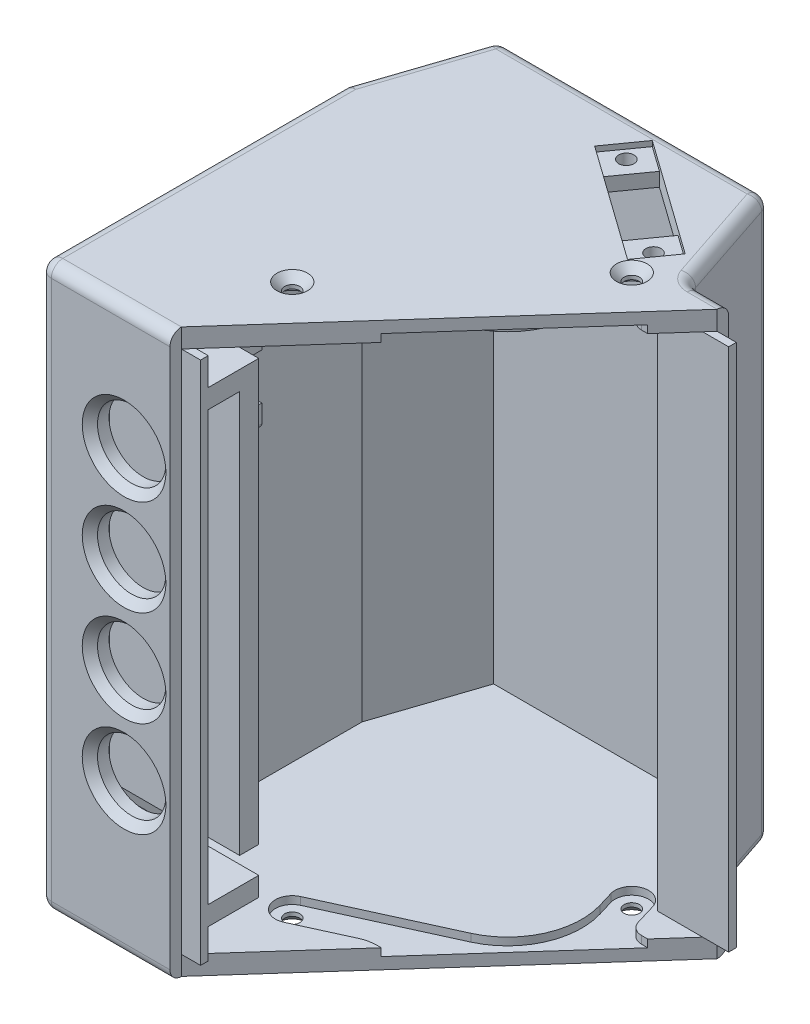
from build123d import *

# Parameters (mm, degrees)
BOSS_EXTRU_1_DEPTH       = 68.5
BOSS_EXTRU_2_DEPTH       = 2.5
ESQUISSE4_R              = 4.465
ENL_V_MAT_EXTRU_1_DEPTH  = 2.5
CHANFREIN1_SIZE          = 1
ESQUISSE6_W              = 6.6
ESQUISSE6_H              = 2.5
BOSS_EXTRU_3_DEPTH       = 17
BOSS_EXTRU_4_DEPTH       = 2.5
CONG_1_R                 = 1.5
ESQUISSE12_R             = 1
ENL_V_MAT_EXTRU_2_DEPTH  = 2.5
CHANFREIN2_SIZE          = 1
ESQUISSE13_R             = 1
ENL_V_MAT_EXTRU_3_DEPTH  = 2.5
CHANFREIN3_SIZE          = 1
ENL_V_MAT_EXTRU_4_DEPTH  = 1
ENL_V_START              = -1
ENL_V_MAT_EXTRU_5_DEPTH  = 1
ENL_V_MAT_EXTRU_6_DEPTH  = 2.5
CHANFREIN4_SIZE          = 0.5
CHANFREIN5_SIZE          = 0.5
BOSS_EXTRU_5_DEPTH       = 4
CONG_2_R                 = 0.5
ESQUISSE19_W             = 2
ESQUISSE19_H             = 6
ENL_V_MAT_EXTRU_7_DEPTH  = 1
BOSS_EXTRU_6_START       = -10.7
BOSS_EXTRU_6_DEPTH       = 9.7
ENL_V_MAT_EXTRU_8_DEPTH  = 2.5
ENL_V_MAT_EXTRU_9_DEPTH  = 0.7
ESQUISSE24_R             = 1
ENL_V_MAT_EXTRU_10_DEPTH = 1.8


with BuildPart() as part:
    # Esquisse1 → Boss.-Extru.1 (new body)
    with BuildSketch(Plane(origin=(0, 0, 0), x_dir=(1, 0, 0), z_dir=(0, 1, 0))):
        Polygon((-33, 1.5), (-35.5, 1.5), (-35.5, 0), (-52.5, 0), (-52.5, 40), (-47.5, 55), (-12.5, 55), (-7.5, 40), (-2.5, 40), (-2.5, 38.5), (0, 38.5), (0, 37.5), (-9.30189805, 37.5), (-14.30189805, 52.5), (-45.69810195, 52.5), (-50, 39.59430585), (-50, 2.5), (-33, 2.5), align=None)
    extrude(amount=BOSS_EXTRU_1_DEPTH)

    # Esquisse2 → Boss.-Extru.2 (add)
    with BuildSketch(Plane.XZ):
        Polygon((-35.5, 0), (-35.5, -1.5), (-2.5, -38.5), (-2.5, -40), (-7.5, -40), (-12.5, -55), (-47.5, -55), (-52.5, -40), (-52.5, 0), align=None)
    extrude(amount=BOSS_EXTRU_2_DEPTH)

    # Esquisse4 → Enlèv. mat.-Extru.1 (cut)
    with BuildSketch(Plane.XY):
        with Locations((-41.5, 55.01)):
            Circle(ESQUISSE4_R)
        with Locations((-41.5, 42.47)):
            Circle(ESQUISSE4_R)
        with Locations((-41.5, 29.93)):
            Circle(ESQUISSE4_R)
        with Locations((-41.5, 17.39)):
            Circle(ESQUISSE4_R)
    extrude(amount=-ENL_V_MAT_EXTRU_1_DEPTH, mode=Mode.SUBTRACT)

    # Chanfrein1
    chanfrein1_edges = [part.edges().sort_by_distance(p)[0] for p in [
        (-45.965, 55.01, 0),
        (-45.965, 42.47, 0),
        (-45.965, 29.93, 0),
        (-45.965, 17.39, 0),
    ]]
    chamfer(chanfrein1_edges, length=CHANFREIN1_SIZE)

    # Esquisse6 → Boss.-Extru.3 (add)
    with BuildSketch(Plane(origin=(-50, 0, 0), x_dir=(0, 0, -1), z_dir=(1, 0, 0))):
        Polygon((2.5, 64.89), (9.1, 64.89), (9.1, 9.89), (6.6, 9.89), (6.6, 62.39), (2.5, 62.39), align=None)
        with Locations((5.8, 5.14)):
            Rectangle(ESQUISSE6_W, ESQUISSE6_H)
    extrude(amount=BOSS_EXTRU_3_DEPTH)

    # Esquisse7 → Boss.-Extru.4 (add)
    with BuildSketch(Plane(origin=(0, 68.5, 0), x_dir=(1, 0, 0), z_dir=(0, 1, 0))):
        Polygon((-35.5, 1.5), (-2.5, 38.5), (-2.5, 40), (-7.5, 40), (-12.5, 55), (-47.5, 55), (-52.5, 40), (-52.5, 0), (-35.5, 0), align=None)
    extrude(amount=BOSS_EXTRU_4_DEPTH)

    # Congé1
    cong_1_edges = [part.edges().sort_by_distance(p)[0] for p in [
        (-5, -2.5, -40),
        (-10, -2.5, -47.5),
        (-30, -2.5, -55),
        (-50, -2.5, -47.5),
        (-52.5, -2.5, -20),
        (-44, -2.5, 0),
        (-7.5, 34.25, -40),
        (-12.5, 34.25, -55),
        (-47.5, 34.25, -55),
        (-52.5, 34.25, -40),
        (-52.5, 34.25, 0),
        (-5, 71, -40),
        (-44, 71, 0),
        (-52.5, 71, -20),
        (-50, 71, -47.5),
        (-30, 71, -55),
        (-10, 71, -47.5),
    ]]
    fillet(cong_1_edges, radius=CONG_1_R)

    # Esquisse12 → Enlèv. mat.-Extru.2 (cut)
    with BuildSketch(Plane(origin=(0, 0, 0), x_dir=(1, 0, 0), z_dir=(0, 1, 0))):
        with Locations(Location((-12.217182507, 37.06068757, 0), (0, 0, 270))):
            Circle(ESQUISSE12_R)
        with Locations(Location((-33.347669282, 13.826357219, 0), (0, 0, 270))):
            Circle(ESQUISSE12_R)
    extrude(amount=-ENL_V_MAT_EXTRU_2_DEPTH, mode=Mode.SUBTRACT)

    # Chanfrein2
    chanfrein2_edges = [part.edges().sort_by_distance(p)[0] for p in [
        (-12.217182507, -2.5, -38.06068757),
        (-33.347669282, -2.5, -14.826357219),
    ]]
    chamfer(chanfrein2_edges, length=CHANFREIN2_SIZE)

    # Esquisse13 → Enlèv. mat.-Extru.3 (cut)
    with BuildSketch(Plane(origin=(0, 71, 0), x_dir=(1, 0, 0), z_dir=(0, 1, 0))):
        with Locations(Location((-12.217182507, 37.06068757, 0), (0, 0, 270))):
            Circle(ESQUISSE13_R)
        with Locations(Location((-33.347669282, 13.826357219, 0), (0, 0, 270))):
            Circle(ESQUISSE13_R)
    extrude(amount=-ENL_V_MAT_EXTRU_3_DEPTH, mode=Mode.SUBTRACT)

    # Chanfrein3
    chanfrein3_edges = [part.edges().sort_by_distance(p)[0] for p in [
        (-12.217182507, 71, -38.06068757),
        (-33.347669282, 71, -14.826357219),
    ]]
    chamfer(chanfrein3_edges, length=CHANFREIN3_SIZE)

    # Esquisse14 → Enlèv. mat.-Extru.4 (cut)
    with BuildSketch(Plane(origin=(0, 0, 0), x_dir=(1, 0, 0), z_dir=(0, 1, 0))):
        with BuildLine():
            Line((-6.512355444, 33.700335826), (-7.570710931, 33.700344839))
            ThreePointArc((-7.570710931, 33.700344839), (-8.644662953, 34.055828638), (-9.294423258, 34.981870335))
            Line((-9.294423258, 34.981870335), (-10.110237679, 37.694114358))
            ThreePointArc((-10.110237679, 37.694114358), (-12.850688251, 39.167182809), (-14.323756703, 36.426732237))
            Line((-14.323756703, 36.426732237), (-13.71729172, 34.410488124))
            ThreePointArc((-13.71729172, 34.410488124), (-14.171147642, 27.612476339), (-18.983736644, 22.789828049))
            Line((-18.983736644, 22.789828049), (-34.259989911, 15.828195457))
            ThreePointArc((-34.259989911, 15.828195457), (-35.349604391, 12.913964806), (-32.43537374, 11.824350327))
            Line((-32.43537374, 11.824350327), (-25.7587423, 14.866997907))
            ThreePointArc((-25.7587423, 14.866997907), (-24.786684785, 15.189880503), (-23.768251931, 15.299166856))
            Line((-23.768251931, 15.299166856), (-22.924490205, 15.299166856))
            Line((-22.924490205, 15.299166856), (-6.512355444, 33.700335826))
        make_face()
    extrude(amount=-ENL_V_MAT_EXTRU_4_DEPTH, mode=Mode.SUBTRACT)

    # Esquisse16 → Enlèv. mat.-Extru.5 (cut)
    with BuildSketch(Plane.XZ.offset(-68.5).offset(ENL_V_START)):
        with BuildLine():
            Line((-34.259992103, -15.828358438), (-18.983864815, -22.789772552))
            ThreePointArc((-18.983864815, -22.789772552), (-14.171195957, -27.612335534), (-13.717109427, -34.410327934))
            Line((-13.717109427, -34.410327934), (-14.323663379, -36.427177652))
            ThreePointArc((-14.323663379, -36.427177652), (-12.850893331, -39.167108011), (-10.110822517, -37.694599294))
            Line((-10.110822517, -37.694599294), (-9.294346308, -34.981614575))
            ThreePointArc((-9.294346308, -34.981614575), (-8.644557788, -34.055746266), (-7.570710931, -33.700341475))
            Line((-7.570710931, -33.700341475), (-6.780764193, -33.700341475))
            Line((-6.780764193, -33.700341475), (-23.192619638, -15.299170219))
            Line((-23.192619638, -15.299170219), (-23.768236602, -15.299166856))
            ThreePointArc((-23.768236602, -15.299166856), (-24.78667926, -15.189881703), (-25.758745961, -14.866996239))
            Line((-25.758745961, -14.866996239), (-32.435327305, -11.82436473))
            ThreePointArc((-32.435327305, -11.82436473), (-35.349666136, -12.91402482), (-34.259992103, -15.828358438))
        make_face()
    extrude(amount=ENL_V_MAT_EXTRU_5_DEPTH, mode=Mode.SUBTRACT)

    # Esquisse17 → Enlèv. mat.-Extru.6 (cut)
    with BuildSketch(Plane(origin=(-50, 0, 0), x_dir=(0, 0, -1), z_dir=(1, 0, 0))):
        with BuildLine():
            Line((12.7, 62.09), (12.7, 55.99))
            ThreePointArc((12.7, 55.99), (10.9, 54.19), (9.1, 55.99))
            Line((9.1, 55.99), (9.1, 62.09))
            ThreePointArc((9.1, 62.09), (10.9, 63.89), (12.7, 62.09))
        make_face()
    extrude(amount=-ENL_V_MAT_EXTRU_6_DEPTH, mode=Mode.SUBTRACT)

    # Chanfrein4
    chanfrein4_edges = [part.edges().sort_by_distance(p)[0] for p in [
        (-52.5, 63.89, -10.9),
        (-52.5, 59.04, -12.7),
        (-52.5, 54.19, -10.9),
        (-52.5, 59.04, -9.1),
    ]]
    chamfer(chanfrein4_edges, length=CHANFREIN4_SIZE)

    # Chanfrein5
    chanfrein5_edges = [part.edges().sort_by_distance(p)[0] for p in [
        (-50, 63.89, -10.9),
        (-50, 54.19, -10.9),
        (-50, 59.04, -12.7),
    ]]
    chamfer(chanfrein5_edges, length=CHANFREIN5_SIZE)

    # Esquisse18 → Boss.-Extru.5 (add)
    with BuildSketch(Plane(origin=(0, 0, -9.1), x_dir=(-1, 0, 0), z_dir=(0, 0, -1))):
        Polygon((50, 63.89), (37.6, 63.89), (37.6, 54.19), (50, 54.19), (50, 53.19), (36.6, 53.19), (36.6, 64.89), (50, 64.89), align=None)
    extrude(amount=BOSS_EXTRU_5_DEPTH)

    # Congé2
    cong_2_edges = [part.edges().sort_by_distance(p)[0] for p in [
        (-36.6, 64.89, -11.1),
        (-36.6, 53.19, -11.1),
    ]]
    fillet(cong_2_edges, radius=CONG_2_R)

    # Esquisse19 → Enlèv. mat.-Extru.7 (cut)
    with BuildSketch(Plane(origin=(-36.6, 0, 0), x_dir=(0, 0, -1), z_dir=(1, 0, 0))):
        with Locations((12.1, 59.04)):
            Rectangle(ESQUISSE19_W, ESQUISSE19_H)
    extrude(amount=-ENL_V_MAT_EXTRU_7_DEPTH, mode=Mode.SUBTRACT)

    # Esquisse20 → Boss.-Extru.6 (add)
    with BuildSketch(Plane.XZ.offset(-53.19).offset(BOSS_EXTRU_6_START)):
        Polygon((-37.6, -9.1), (-37.6, -10.1), (-41, -9.1), align=None)
    extrude(amount=BOSS_EXTRU_6_DEPTH)

    # Esquisse22 → Enlèv. mat.-Extru.8 (cut)
    with BuildSketch(Plane(origin=(0, 71, 0), x_dir=(1, 0, 0), z_dir=(0, 1, 0))):
        Polygon((-22.58113883, 51.038579412), (-14.113815836, 45), (-17.249232069, 40.603505368), (-25.716555063, 46.64208478), align=None)
    extrude(amount=-ENL_V_MAT_EXTRU_8_DEPTH, mode=Mode.SUBTRACT)

    # Esquisse23 → Enlèv. mat.-Extru.9 (cut)
    with BuildSketch(Plane(origin=(0, 71, 0), x_dir=(1, 0, 0), z_dir=(0, 1, 0))):
        Polygon((-28.973217753, 48.964615323), (-13.992569379, 38.280974825), (-10.857153146, 42.677469457), (-25.83780152, 53.361109955), align=None)
    extrude(amount=-ENL_V_MAT_EXTRU_9_DEPTH, mode=Mode.SUBTRACT)

    # Esquisse24 → Enlèv. mat.-Extru.10 (cut)
    with BuildSketch(Plane(origin=(0, 70.3, 0), x_dir=(1, 0, 0), z_dir=(0, 1, 0))):
        with Locations(Location((-13.727526338, 41.408234358, 0), (0, 0, 270))):
            Circle(ESQUISSE24_R)
        with Locations(Location((-26.102844561, 50.233850422, 0), (0, 0, 270))):
            Circle(ESQUISSE24_R)
    extrude(amount=-ENL_V_MAT_EXTRU_10_DEPTH, mode=Mode.SUBTRACT)


solid = part.part
